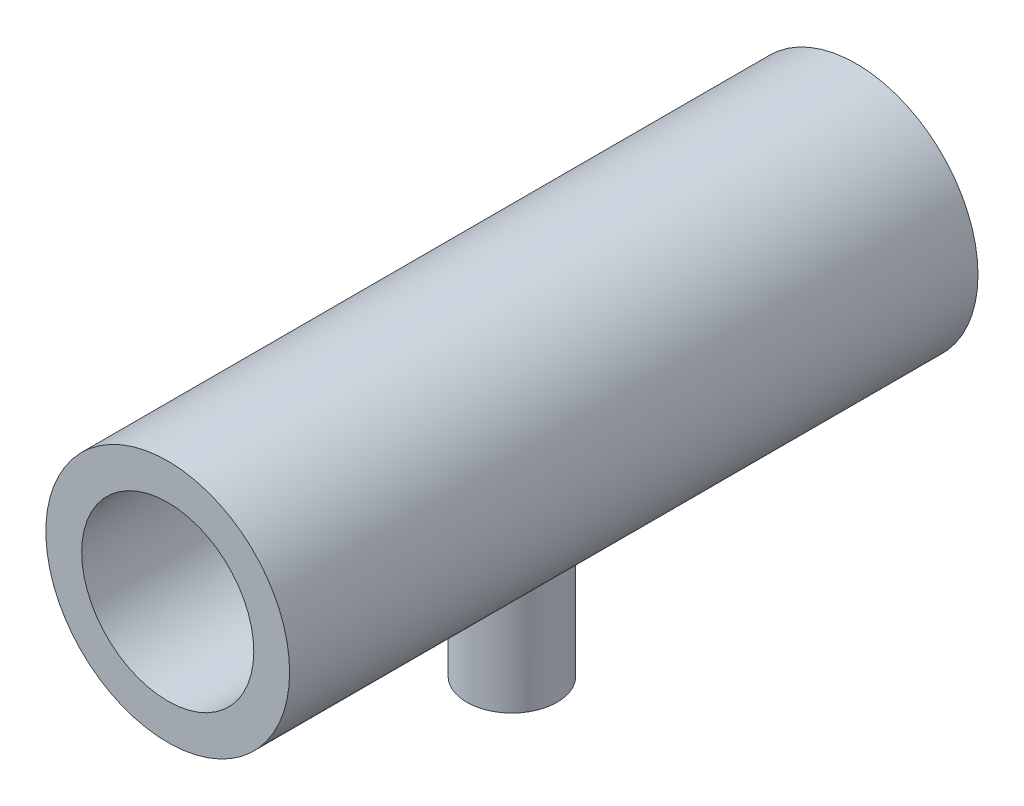
from build123d import *

# Parameters (mm, degrees)
SWEEP1_PROFILE_R         = 13.49375
CUT_SWEEP1_PROFILE_R     = 9.525
BOSS_EXTRUDE2_DEPTH      = 12.7
BOSS_EXTRUDE2_DEPTH_BACK = 2.54
SKETCH2_R                = 5
CUT_EXTRUDE1_REACH       = 88.969
SKETCH3_R                = 3.73


with BuildPart() as part:
    # Sweep1: sweep along a curve in space
    with BuildLine() as sweep1_path:
        Line((0, 0, 0), (0, 0, 76.2))
    # Sweep1 profile (on start of the path) → Sweep1 (sweep)
    with BuildSketch(Plane.XY):
        Circle(SWEEP1_PROFILE_R)
    sweep(path=sweep1_path.line)

    # Cut-Sweep1: sweep along a curve in space
    with BuildLine() as cut_sweep1_path:
        Line((0, 0, 0), (0, 0, 76.2))
    # Cut-Sweep1 profile (on start of the path) → Cut-Sweep1 (sweep, cut)
    with BuildSketch(Plane.XY):
        Circle(CUT_SWEEP1_PROFILE_R)
    sweep(path=cut_sweep1_path.line, mode=Mode.SUBTRACT)

    # Sketch2 → Boss-Extrude2 (add, two sides: drawn at the far end of the back side and taken through both)
    with BuildSketch(Plane(origin=(0, -13.49375, 0), x_dir=(-1, 0, 0), z_dir=(0, -1, 0)).offset(-BOSS_EXTRUDE2_DEPTH_BACK)):
        with Locations((0, -38.1)):
            Circle(SKETCH2_R)
    extrude(amount=BOSS_EXTRUDE2_DEPTH + BOSS_EXTRUDE2_DEPTH_BACK)

    # Sketch3 → Cut-Extrude1 (cut, up to next)
    with BuildSketch(Plane.XZ.offset(26.19375), mode=Mode.PRIVATE) as cut_extrude1_sk1:
        with Locations((0, 38.1)):
            Circle(SKETCH3_R)
    cut_extrude1_tool1 = extrude(cut_extrude1_sk1.sketch, amount=-CUT_EXTRUDE1_REACH, mode=Mode.PRIVATE) & part.part
    add(cut_extrude1_tool1.solids().sort_by_distance((0, -26.19375, 38.1))[0], mode=Mode.SUBTRACT)


solid = part.part
